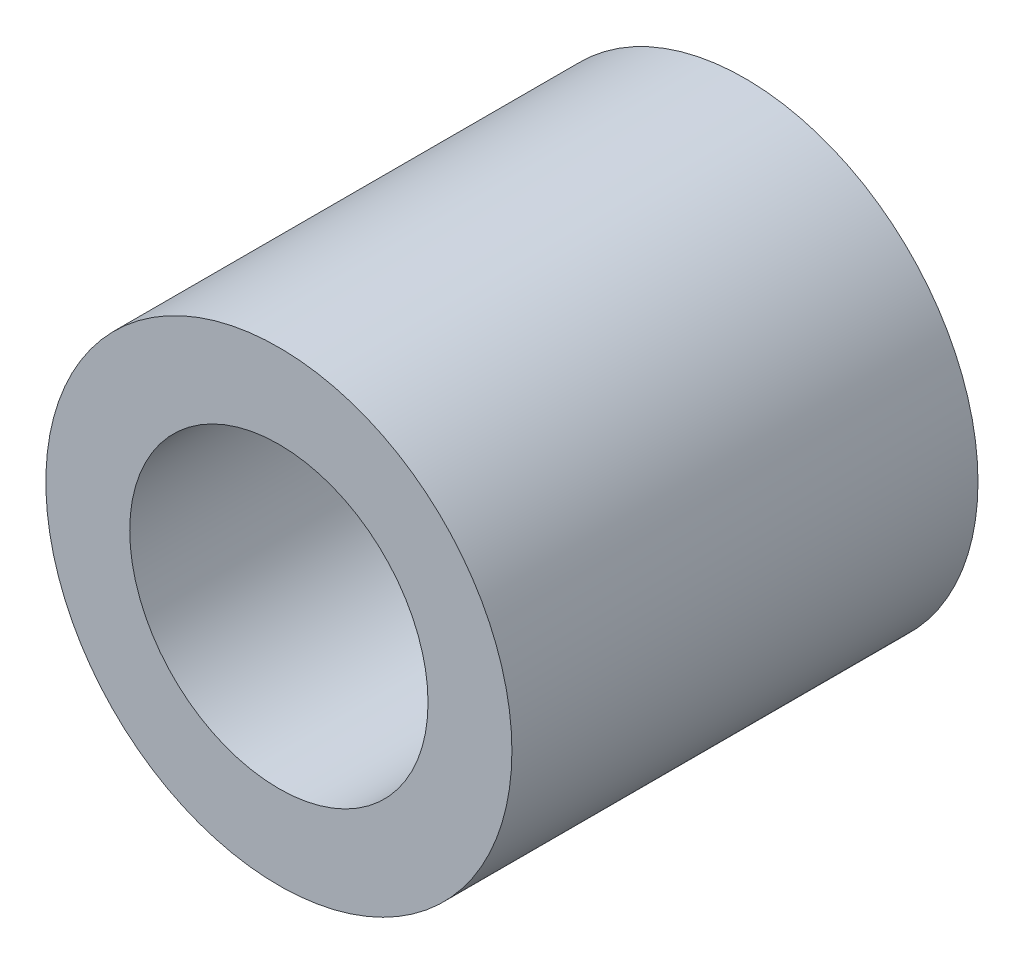
from build123d import *

# Parameters (mm, degrees)
SKETCH_1_R      = 2.5
SKETCH_1_R_2    = 1.6
EXTRUDE_1_DEPTH = 5


with BuildPart() as part:
    # 草图1 → 凸台-拉伸1 (new body)
    with BuildSketch(Plane.XY):
        Circle(SKETCH_1_R)
        Circle(SKETCH_1_R_2, mode=Mode.SUBTRACT)
    extrude(amount=EXTRUDE_1_DEPTH)


solid = part.part
